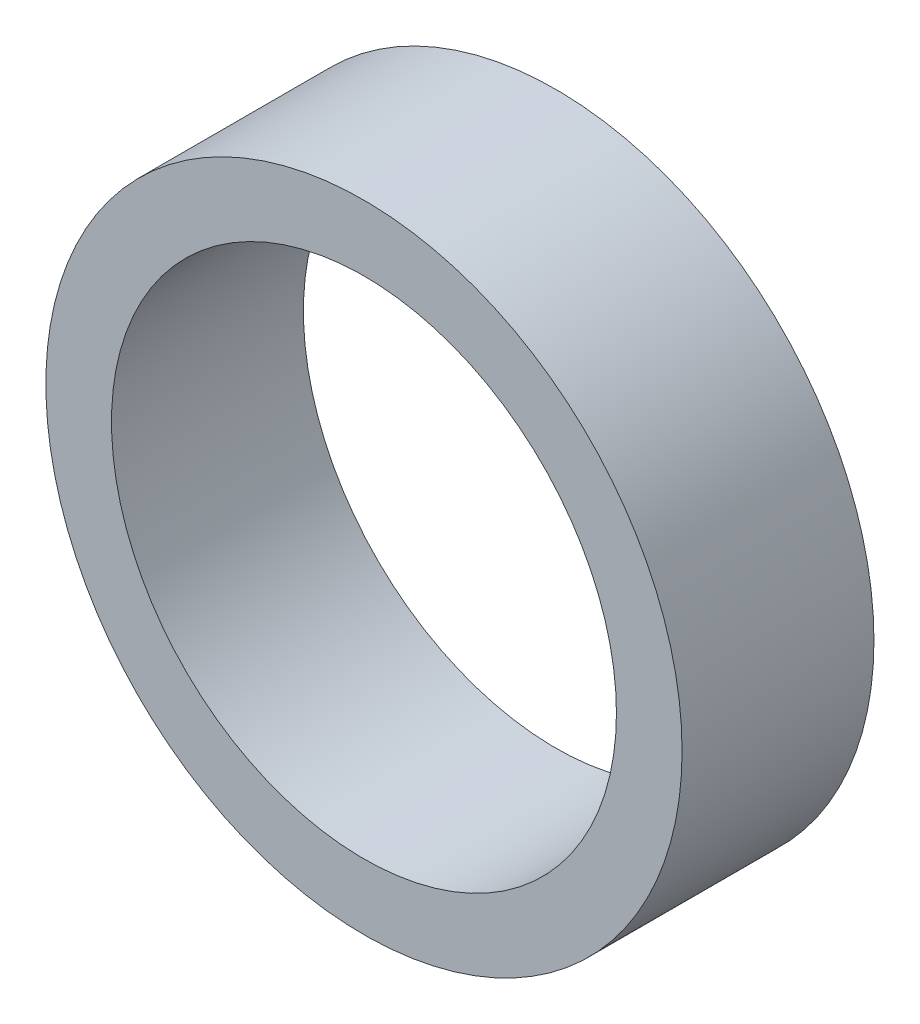
from build123d import *

# Parameters (mm, degrees)
CROQUIS1_R              = 31.5
CROQUIS1_R_2            = 25
SALIENTE_EXTRUIR1_DEPTH = 19


with BuildPart() as part:
    # Croquis1 → Saliente-Extruir1 (new body)
    with BuildSketch(Plane.XY):
        Circle(CROQUIS1_R)
        Circle(CROQUIS1_R_2, mode=Mode.SUBTRACT)
    extrude(amount=-SALIENTE_EXTRUIR1_DEPTH)


solid = part.part
